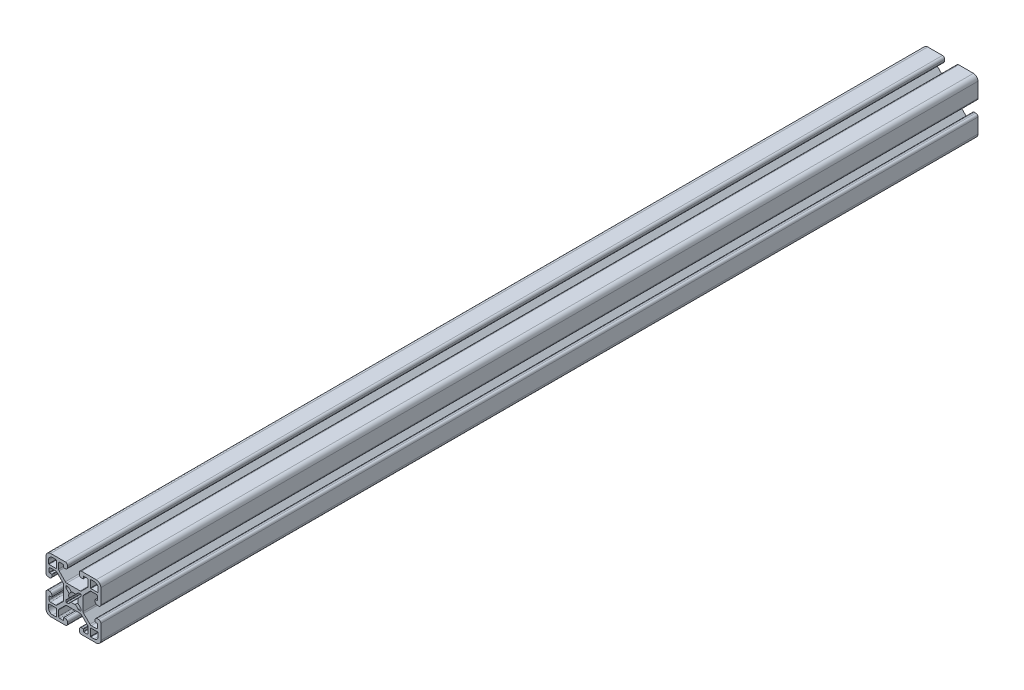
from build123d import *

# Parameters (mm, degrees)
BOSS_EXTRUDE1_DEPTH = 609.6


with BuildPart() as part:
    # Sketch1 → Boss-Extrude1 (new body)
    with BuildSketch(Plane(origin=(0, 0, -609.6), x_dir=(-1, 0, 0), z_dir=(0, 0, -1))):
        with BuildLine():
            Line((17.4752, -4.064), (16.5608, -4.064))
            ThreePointArc((16.5608, -4.064), (15.447248241, -4.525248241), (14.986, -5.6388))
            Line((14.986, -5.6388), (14.986, -6.617745083))
            ThreePointArc((14.986, -6.617745083), (15.060394878, -6.797350205), (15.24, -6.871745083))
            Line((15.24, -6.871745083), (16.5862, -6.871745083))
            ThreePointArc((16.5862, -6.871745083), (16.765805122, -6.946139961), (16.8402, -7.125745083))
            Line((16.8402, -7.125745083), (16.8402, -9.411745083))
            ThreePointArc((16.8402, -9.411745083), (16.579817928, -10.040363011), (15.9512, -10.300745083))
            Line((15.9512, -10.300745083), (12.389360872, -10.300745083))
            ThreePointArc((12.389360872, -10.300745083), (11.903352913, -10.204072089), (11.49133526, -9.928770695))
            Line((11.49133526, -9.928770695), (7.115699788, -5.553135223))
            ThreePointArc((7.115699788, -5.553135223), (6.840398394, -5.14111757), (6.7437254, -4.655109611))
            Line((6.7437254, -4.655109611), (6.7437254, 4.655109611))
            ThreePointArc((6.7437254, 4.655109611), (6.840398394, 5.14111757), (7.115699788, 5.553135223))
            Line((7.115699788, 5.553135223), (11.49133526, 9.928770695))
            ThreePointArc((11.49133526, 9.928770695), (11.903352913, 10.204072089), (12.389360872, 10.300745083))
            Line((12.389360872, 10.300745083), (15.9512, 10.300745083))
            ThreePointArc((15.9512, 10.300745083), (16.579817928, 10.040363011), (16.8402, 9.411745083))
            Line((16.8402, 9.411745083), (16.8402, 7.125745083))
            ThreePointArc((16.8402, 7.125745083), (16.765805122, 6.946139961), (16.5862, 6.871745083))
            Line((16.5862, 6.871745083), (15.24, 6.871745083))
            ThreePointArc((15.24, 6.871745083), (15.060394878, 6.797350205), (14.986, 6.617745083))
            Line((14.986, 6.617745083), (14.986, 5.6388))
            ThreePointArc((14.986, 5.6388), (15.447248241, 4.525248241), (16.5608, 4.064))
            Line((16.5608, 4.064), (17.4752, 4.064))
            ThreePointArc((17.4752, 4.064), (18.588751759, 4.525248241), (19.05, 5.6388))
            Line((19.05, 5.6388), (19.05, 15.875))
            ThreePointArc((19.05, 15.875), (18.12006403, 18.12006403), (15.875, 19.05))
            Line((15.875, 19.05), (5.6388, 19.05))
            ThreePointArc((5.6388, 19.05), (4.525248241, 18.588751759), (4.064, 17.4752))
            Line((4.064, 17.4752), (4.064, 16.5608))
            ThreePointArc((4.064, 16.5608), (4.525248241, 15.447248241), (5.6388, 14.986))
            Line((5.6388, 14.986), (6.617745083, 14.986))
            ThreePointArc((6.617745083, 14.986), (6.797350205, 15.060394878), (6.871745083, 15.24))
            Line((6.871745083, 15.24), (6.871745083, 16.5862))
            ThreePointArc((6.871745083, 16.5862), (6.946139961, 16.765805122), (7.125745083, 16.8402))
            Line((7.125745083, 16.8402), (9.411745083, 16.8402))
            ThreePointArc((9.411745083, 16.8402), (10.040363011, 16.579817928), (10.300745083, 15.9512))
            Line((10.300745083, 15.9512), (10.300745083, 12.389360872))
            ThreePointArc((10.300745083, 12.389360872), (10.204072089, 11.903352913), (9.928770695, 11.49133526))
            Line((9.928770695, 11.49133526), (5.553135223, 7.115699788))
            ThreePointArc((5.553135223, 7.115699788), (5.14111757, 6.840398394), (4.655109611, 6.7437254))
            Line((4.655109611, 6.7437254), (-4.655109611, 6.7437254))
            ThreePointArc((-4.655109611, 6.7437254), (-5.14111757, 6.840398394), (-5.553135223, 7.115699788))
            Line((-5.553135223, 7.115699788), (-9.928770695, 11.49133526))
            ThreePointArc((-9.928770695, 11.49133526), (-10.204072089, 11.903352913), (-10.300745083, 12.389360872))
            Line((-10.300745083, 12.389360872), (-10.300745083, 15.9512))
            ThreePointArc((-10.300745083, 15.9512), (-10.040363011, 16.579817928), (-9.411745083, 16.8402))
            Line((-9.411745083, 16.8402), (-7.125745083, 16.8402))
            ThreePointArc((-7.125745083, 16.8402), (-6.946139961, 16.765805122), (-6.871745083, 16.5862))
            Line((-6.871745083, 16.5862), (-6.871745083, 15.24))
            ThreePointArc((-6.871745083, 15.24), (-6.797350205, 15.060394878), (-6.617745083, 14.986))
            Line((-6.617745083, 14.986), (-5.6388, 14.986))
            ThreePointArc((-5.6388, 14.986), (-4.525248241, 15.447248241), (-4.064, 16.5608))
            Line((-4.064, 16.5608), (-4.064, 17.4752))
            ThreePointArc((-4.064, 17.4752), (-4.525248241, 18.588751759), (-5.6388, 19.05))
            Line((-5.6388, 19.05), (-15.875, 19.05))
            ThreePointArc((-15.875, 19.05), (-18.12006403, 18.12006403), (-19.05, 15.875))
            Line((-19.05, 15.875), (-19.05, 5.6388))
            ThreePointArc((-19.05, 5.6388), (-18.588751759, 4.525248241), (-17.4752, 4.064))
            Line((-17.4752, 4.064), (-16.5608, 4.064))
            ThreePointArc((-16.5608, 4.064), (-15.447248241, 4.525248241), (-14.986, 5.6388))
            Line((-14.986, 5.6388), (-14.986, 6.617745083))
            ThreePointArc((-14.986, 6.617745083), (-15.060394878, 6.797350205), (-15.24, 6.871745083))
            Line((-15.24, 6.871745083), (-16.5862, 6.871745083))
            ThreePointArc((-16.5862, 6.871745083), (-16.765805122, 6.946139961), (-16.8402, 7.125745083))
            Line((-16.8402, 7.125745083), (-16.8402, 9.411745083))
            ThreePointArc((-16.8402, 9.411745083), (-16.579817928, 10.040363011), (-15.9512, 10.300745083))
            Line((-15.9512, 10.300745083), (-12.389360872, 10.300745083))
            ThreePointArc((-12.389360872, 10.300745083), (-11.903352913, 10.204072089), (-11.49133526, 9.928770695))
            Line((-11.49133526, 9.928770695), (-7.115699788, 5.553135223))
            ThreePointArc((-7.115699788, 5.553135223), (-6.840398394, 5.14111757), (-6.7437254, 4.655109611))
            Line((-6.7437254, 4.655109611), (-6.7437254, -4.655109611))
            ThreePointArc((-6.7437254, -4.655109611), (-6.840398394, -5.14111757), (-7.115699788, -5.553135223))
            Line((-7.115699788, -5.553135223), (-11.49133526, -9.928770695))
            ThreePointArc((-11.49133526, -9.928770695), (-11.903352913, -10.204072089), (-12.389360872, -10.300745083))
            Line((-12.389360872, -10.300745083), (-15.9512, -10.300745083))
            ThreePointArc((-15.9512, -10.300745083), (-16.579817928, -10.040363011), (-16.8402, -9.411745083))
            Line((-16.8402, -9.411745083), (-16.8402, -7.125745083))
            ThreePointArc((-16.8402, -7.125745083), (-16.765805122, -6.946139961), (-16.5862, -6.871745083))
            Line((-16.5862, -6.871745083), (-15.24, -6.871745083))
            ThreePointArc((-15.24, -6.871745083), (-15.060394878, -6.797350205), (-14.986, -6.617745083))
            Line((-14.986, -6.617745083), (-14.986, -5.6388))
            ThreePointArc((-14.986, -5.6388), (-15.447248241, -4.525248241), (-16.5608, -4.064))
            Line((-16.5608, -4.064), (-17.4752, -4.064))
            ThreePointArc((-17.4752, -4.064), (-18.588751759, -4.525248241), (-19.05, -5.6388))
            Line((-19.05, -5.6388), (-19.05, -15.875))
            ThreePointArc((-19.05, -15.875), (-18.12006403, -18.12006403), (-15.875, -19.05))
            Line((-15.875, -19.05), (-5.6388, -19.05))
            ThreePointArc((-5.6388, -19.05), (-4.525248241, -18.588751759), (-4.064, -17.4752))
            Line((-4.064, -17.4752), (-4.064, -16.5608))
            ThreePointArc((-4.064, -16.5608), (-4.525248241, -15.447248241), (-5.6388, -14.986))
            Line((-5.6388, -14.986), (-6.617745083, -14.986))
            ThreePointArc((-6.617745083, -14.986), (-6.797350205, -15.060394878), (-6.871745083, -15.24))
            Line((-6.871745083, -15.24), (-6.871745083, -16.5862))
            ThreePointArc((-6.871745083, -16.5862), (-6.946139961, -16.765805122), (-7.125745083, -16.8402))
            Line((-7.125745083, -16.8402), (-9.411745083, -16.8402))
            ThreePointArc((-9.411745083, -16.8402), (-10.040363011, -16.579817928), (-10.300745083, -15.9512))
            Line((-10.300745083, -15.9512), (-10.300745083, -12.389360872))
            ThreePointArc((-10.300745083, -12.389360872), (-10.204072089, -11.903352913), (-9.928770695, -11.49133526))
            Line((-9.928770695, -11.49133526), (-5.553135223, -7.115699788))
            ThreePointArc((-5.553135223, -7.115699788), (-5.14111757, -6.840398394), (-4.655109611, -6.7437254))
            Line((-4.655109611, -6.7437254), (4.655109611, -6.7437254))
            ThreePointArc((4.655109611, -6.7437254), (5.14111757, -6.840398394), (5.553135223, -7.115699788))
            Line((5.553135223, -7.115699788), (9.928770695, -11.49133526))
            ThreePointArc((9.928770695, -11.49133526), (10.204072089, -11.903352913), (10.300745083, -12.389360872))
            Line((10.300745083, -12.389360872), (10.300745083, -15.9512))
            ThreePointArc((10.300745083, -15.9512), (10.040363011, -16.579817928), (9.411745083, -16.8402))
            Line((9.411745083, -16.8402), (7.125745083, -16.8402))
            ThreePointArc((7.125745083, -16.8402), (6.946139961, -16.765805122), (6.871745083, -16.5862))
            Line((6.871745083, -16.5862), (6.871745083, -15.24))
            ThreePointArc((6.871745083, -15.24), (6.797350205, -15.060394878), (6.617745083, -14.986))
            Line((6.617745083, -14.986), (5.6388, -14.986))
            ThreePointArc((5.6388, -14.986), (4.525248241, -15.447248241), (4.064, -16.5608))
            Line((4.064, -16.5608), (4.064, -17.4752))
            ThreePointArc((4.064, -17.4752), (4.525248241, -18.588751759), (5.6388, -19.05))
            Line((5.6388, -19.05), (15.875, -19.05))
            ThreePointArc((15.875, -19.05), (18.12006403, -18.12006403), (19.05, -15.875))
            Line((19.05, -15.875), (19.05, -5.6388))
            ThreePointArc((19.05, -5.6388), (18.588751759, -4.525248241), (17.4752, -4.064))
        make_face()
        with BuildLine():
            Line((17.260345083, 14.466345083), (17.260345083, 12.129545083))
            ThreePointArc((17.260345083, 12.129545083), (17.185950205, 11.949939961), (17.006345083, 11.875545083))
            Line((17.006345083, 11.875545083), (12.129545083, 11.875545083))
            ThreePointArc((12.129545083, 11.875545083), (11.949939961, 11.949939961), (11.875545083, 12.129545083))
            Line((11.875545083, 12.129545083), (11.875545083, 17.006345083))
            ThreePointArc((11.875545083, 17.006345083), (11.949939961, 17.185950205), (12.129545083, 17.260345083))
            Line((12.129545083, 17.260345083), (14.466345083, 17.260345083))
            ThreePointArc((14.466345083, 17.260345083), (16.44200143, 16.44200143), (17.260345083, 14.466345083))
        make_face(mode=Mode.SUBTRACT)
        with BuildLine():
            Line((17.260345083, -12.129545083), (17.260345083, -14.466345083))
            ThreePointArc((17.260345083, -14.466345083), (16.44200143, -16.44200143), (14.466345083, -17.260345083))
            Line((14.466345083, -17.260345083), (12.129545083, -17.260345083))
            ThreePointArc((12.129545083, -17.260345083), (11.949939961, -17.185950205), (11.875545083, -17.006345083))
            Line((11.875545083, -17.006345083), (11.875545083, -12.129545083))
            ThreePointArc((11.875545083, -12.129545083), (11.949939961, -11.949939961), (12.129545083, -11.875545083))
            Line((12.129545083, -11.875545083), (17.006345083, -11.875545083))
            ThreePointArc((17.006345083, -11.875545083), (17.185950205, -11.949939961), (17.260345083, -12.129545083))
        make_face(mode=Mode.SUBTRACT)
        with BuildLine():
            Line((5.1689254, -3.920715155), (5.1689254, -4.9149254))
            ThreePointArc((5.1689254, -4.9149254), (5.094530522, -5.094530522), (4.9149254, -5.1689254))
            Line((4.9149254, -5.1689254), (3.920715155, -5.1689254))
            ThreePointArc((3.920715155, -5.1689254), (3.580509584, -5.101254304), (3.292097227, -4.908543328))
            Line((3.292097227, -4.908543328), (1.401430967, -3.017877069))
            ThreePointArc((1.401430967, -3.017877069), (0, -3.3274), (-1.401430967, -3.017877069))
            Line((-1.401430967, -3.017877069), (-3.292097227, -4.908543328))
            ThreePointArc((-3.292097227, -4.908543328), (-3.580509584, -5.101254304), (-3.920715155, -5.1689254))
            Line((-3.920715155, -5.1689254), (-4.9149254, -5.1689254))
            ThreePointArc((-4.9149254, -5.1689254), (-5.094530522, -5.094530522), (-5.1689254, -4.9149254))
            Line((-5.1689254, -4.9149254), (-5.1689254, -3.920715155))
            ThreePointArc((-5.1689254, -3.920715155), (-5.101254304, -3.580509584), (-4.908543328, -3.292097227))
            Line((-4.908543328, -3.292097227), (-3.017877069, -1.401430967))
            ThreePointArc((-3.017877069, -1.401430967), (-3.3274, 0), (-3.017877069, 1.401430967))
            Line((-3.017877069, 1.401430967), (-4.908543328, 3.292097227))
            ThreePointArc((-4.908543328, 3.292097227), (-5.101254304, 3.580509584), (-5.1689254, 3.920715155))
            Line((-5.1689254, 3.920715155), (-5.1689254, 4.9149254))
            ThreePointArc((-5.1689254, 4.9149254), (-5.094530522, 5.094530522), (-4.9149254, 5.1689254))
            Line((-4.9149254, 5.1689254), (-3.920715155, 5.1689254))
            ThreePointArc((-3.920715155, 5.1689254), (-3.580509584, 5.101254304), (-3.292097227, 4.908543328))
            Line((-3.292097227, 4.908543328), (-1.401430967, 3.017877069))
            ThreePointArc((-1.401430967, 3.017877069), (0, 3.3274), (1.401430967, 3.017877069))
            Line((1.401430967, 3.017877069), (3.292097227, 4.908543328))
            ThreePointArc((3.292097227, 4.908543328), (3.580509584, 5.101254304), (3.920715155, 5.1689254))
            Line((3.920715155, 5.1689254), (4.9149254, 5.1689254))
            ThreePointArc((4.9149254, 5.1689254), (5.094530522, 5.094530522), (5.1689254, 4.9149254))
            Line((5.1689254, 4.9149254), (5.1689254, 3.920715155))
            ThreePointArc((5.1689254, 3.920715155), (5.101254304, 3.580509584), (4.908543328, 3.292097227))
            Line((4.908543328, 3.292097227), (3.017877069, 1.401430967))
            ThreePointArc((3.017877069, 1.401430967), (3.3274, 0), (3.017877069, -1.401430967))
            Line((3.017877069, -1.401430967), (4.908543328, -3.292097227))
            ThreePointArc((4.908543328, -3.292097227), (5.101254304, -3.580509584), (5.1689254, -3.920715155))
        make_face(mode=Mode.SUBTRACT)
        with BuildLine():
            Line((-11.875545083, -12.129545083), (-11.875545083, -17.006345083))
            ThreePointArc((-11.875545083, -17.006345083), (-11.949939961, -17.185950205), (-12.129545083, -17.260345083))
            Line((-12.129545083, -17.260345083), (-14.466345083, -17.260345083))
            ThreePointArc((-14.466345083, -17.260345083), (-16.44200143, -16.44200143), (-17.260345083, -14.466345083))
            Line((-17.260345083, -14.466345083), (-17.260345083, -12.129545083))
            ThreePointArc((-17.260345083, -12.129545083), (-17.185950205, -11.949939961), (-17.006345083, -11.875545083))
            Line((-17.006345083, -11.875545083), (-12.129545083, -11.875545083))
            ThreePointArc((-12.129545083, -11.875545083), (-11.949939961, -11.949939961), (-11.875545083, -12.129545083))
        make_face(mode=Mode.SUBTRACT)
        with BuildLine():
            Line((-11.875545083, 17.006345083), (-11.875545083, 12.129545083))
            ThreePointArc((-11.875545083, 12.129545083), (-11.949939961, 11.949939961), (-12.129545083, 11.875545083))
            Line((-12.129545083, 11.875545083), (-17.006345083, 11.875545083))
            ThreePointArc((-17.006345083, 11.875545083), (-17.185950205, 11.949939961), (-17.260345083, 12.129545083))
            Line((-17.260345083, 12.129545083), (-17.260345083, 14.466345083))
            ThreePointArc((-17.260345083, 14.466345083), (-16.44200143, 16.44200143), (-14.466345083, 17.260345083))
            Line((-14.466345083, 17.260345083), (-12.129545083, 17.260345083))
            ThreePointArc((-12.129545083, 17.260345083), (-11.949939961, 17.185950205), (-11.875545083, 17.006345083))
        make_face(mode=Mode.SUBTRACT)
    extrude(amount=-BOSS_EXTRUDE1_DEPTH)


solid = part.part
